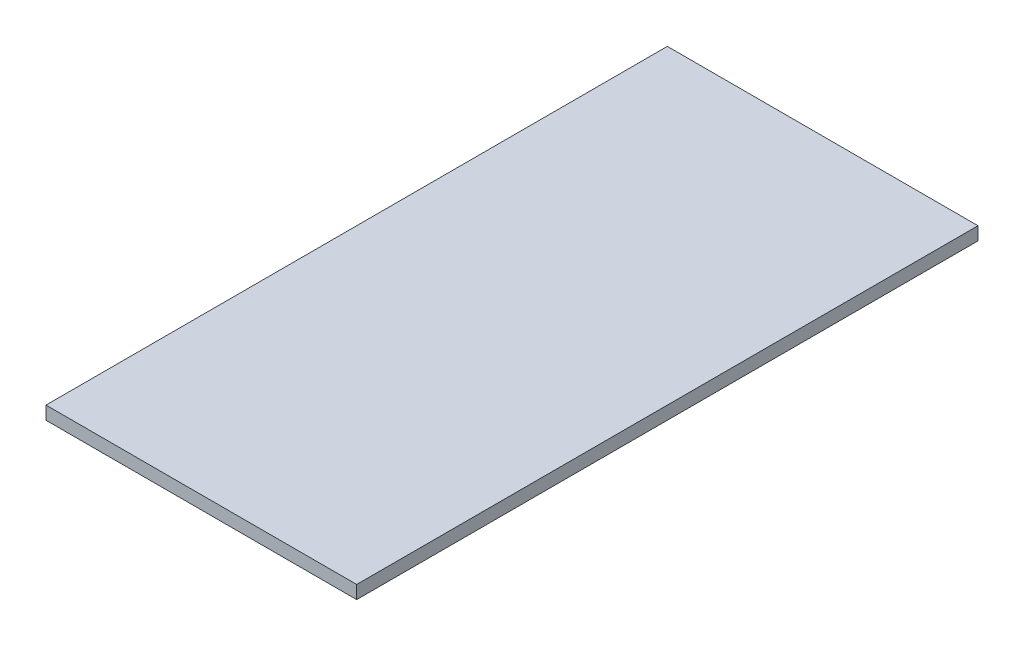
from build123d import *

# Parameters (mm, degrees)
SKETCH1_W           = 150
SKETCH1_H           = 300
BOSS_EXTRUDE1_DEPTH = 6.35


with BuildPart() as part:
    # Sketch1 → Boss-Extrude1 (new body)
    with BuildSketch(Plane(origin=(0, 0, 0), x_dir=(1, 0, 0), z_dir=(0, 1, 0))):
        Rectangle(SKETCH1_W, SKETCH1_H)
    extrude(amount=BOSS_EXTRUDE1_DEPTH)


solid = part.part
